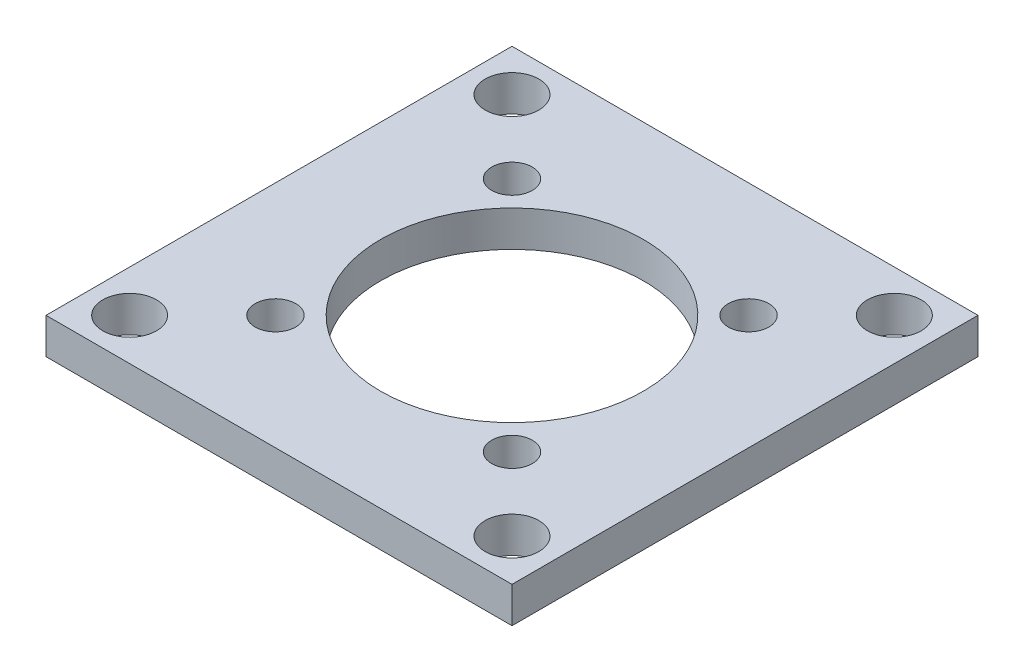
from build123d import *

# Parameters (mm, degrees)
SKETCH1_W            = 39
SKETCH1_H            = 39
SKETCH1_R            = 11
BOSS_EXTRUDE1_DEPTH  = 3
M3_CLEARANCE_HOLE1_D = 3.4
M4_CLEARANCE_HOLE1_D = 4.5


with BuildPart() as part:
    # Sketch1 → Boss-Extrude1 (new body)
    with BuildSketch(Plane(origin=(0, 0, 0), x_dir=(1, 0, 0), z_dir=(0, 1, 0))):
        Rectangle(SKETCH1_W, SKETCH1_H)
        with Locations(Location((0, 0, 0), (0, 0, 270))):
            Circle(SKETCH1_R, mode=Mode.SUBTRACT)
    extrude(amount=BOSS_EXTRUDE1_DEPTH)

    # M3 Clearance Hole1 (through all)
    with Locations(Plane(origin=(0, 0, 0), x_dir=(-1, 0, 0), z_dir=(0, -1, 0))):
        with Locations((-9.899494937, -9.899494937), (9.899494937, -9.899494937), (9.899494937, 9.899494937), (-9.899494937, 9.899494937)):
            Hole(M3_CLEARANCE_HOLE1_D / 2)

    # M4 Clearance Hole1 (through all)
    with Locations(Plane(origin=(0, 0, 0), x_dir=(-1, 0, 0), z_dir=(0, -1, 0))):
        with Locations((-16, 16), (-16, -16), (16, -16), (16, 16)):
            Hole(M4_CLEARANCE_HOLE1_D / 2)


solid = part.part
